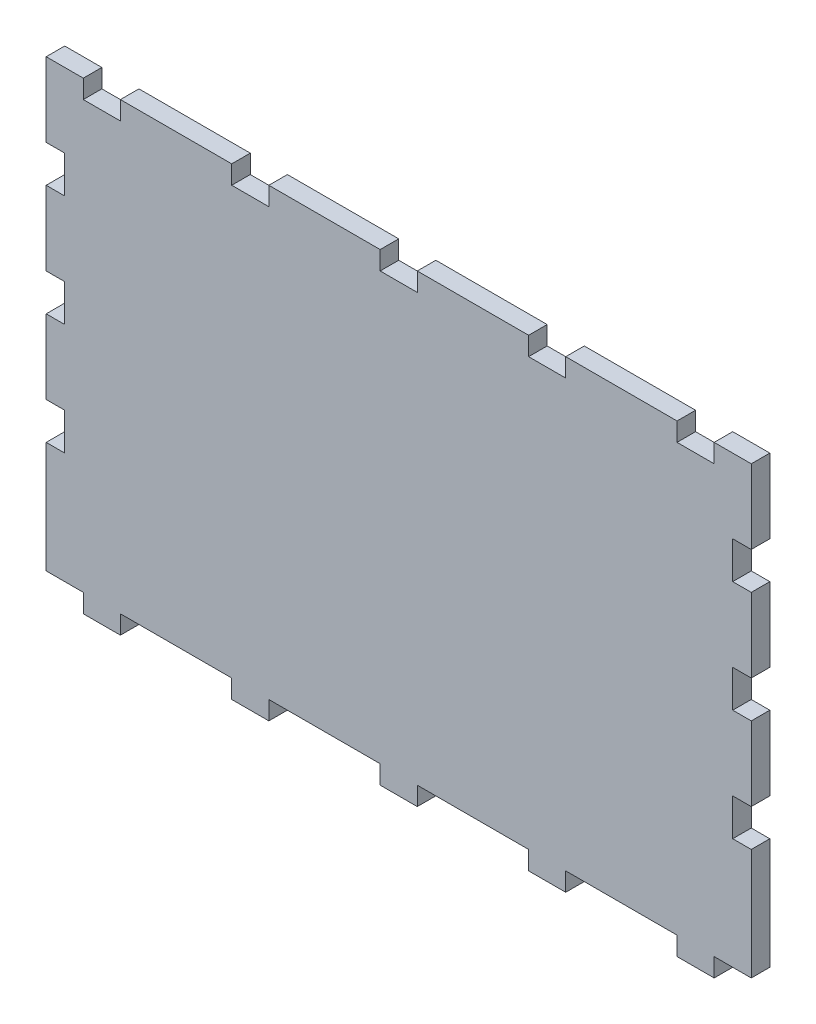
from build123d import *

# Parameters (mm, degrees)
BOSS_EXTRUDE1_DEPTH = 5


with BuildPart() as part:
    # Sketch1 → Boss-Extrude1 (new body)
    with BuildSketch(Plane.XY):
        Polygon((-85, 60), (-85, 55), (-75, 55), (-75, 60), (-45, 60), (-45, 55), (-35, 55), (-35, 60), (-5, 60), (-5, 55), (5, 55), (5, 60), (35, 60), (35, 55), (45, 55), (45, 60), (75, 60), (75, 55), (85, 55), (85, 60), (95, 60), (95, 40), (90, 40), (90, 30), (95, 30), (95, 10), (90, 10), (90, 0), (95, 0), (95, -20), (90, -20), (90, -30), (95, -30), (95, -60), (85, -60), (85, -65), (75, -65), (75, -60), (45, -60), (45, -65), (35, -65), (35, -60), (5, -60), (5, -65), (-5, -65), (-5, -60), (-35, -60), (-35, -65), (-45, -65), (-45, -60), (-75, -60), (-75, -65), (-85, -65), (-85, -60), (-95, -60), (-95, -30), (-90, -30), (-90, -20), (-95, -20), (-95, 0), (-90, 0), (-90, 10), (-95, 10), (-95, 30), (-90, 30), (-90, 40), (-95, 40), (-95, 60), align=None)
    extrude(amount=BOSS_EXTRUDE1_DEPTH)


solid = part.part
